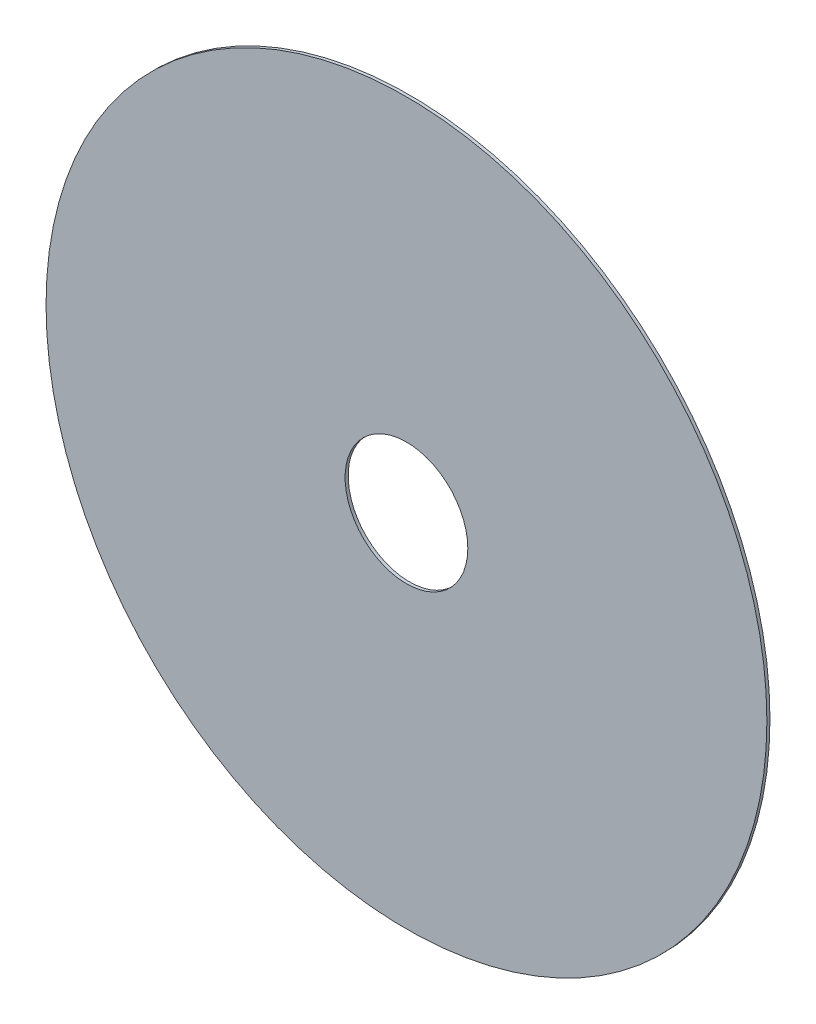
from build123d import *

# Parameters (mm, degrees)
SKETCH1_R                 = 29.845
BOSS_EXTRUDE1_DEPTH       = 0.254
F_97_0_4_DIAMETER_HOLE1_D = 10.16


with BuildPart() as part:
    # Sketch1 → Boss-Extrude1 (new body)
    with BuildSketch(Plane.XY):
        Circle(SKETCH1_R)
    extrude(amount=BOSS_EXTRUDE1_DEPTH)

    # #97 (0.4) Diameter Hole1 (through all)
    with Locations(Plane.XY.offset(0.254)):
        with Locations((0, 0)):
            Hole(F_97_0_4_DIAMETER_HOLE1_D / 2)


solid = part.part
